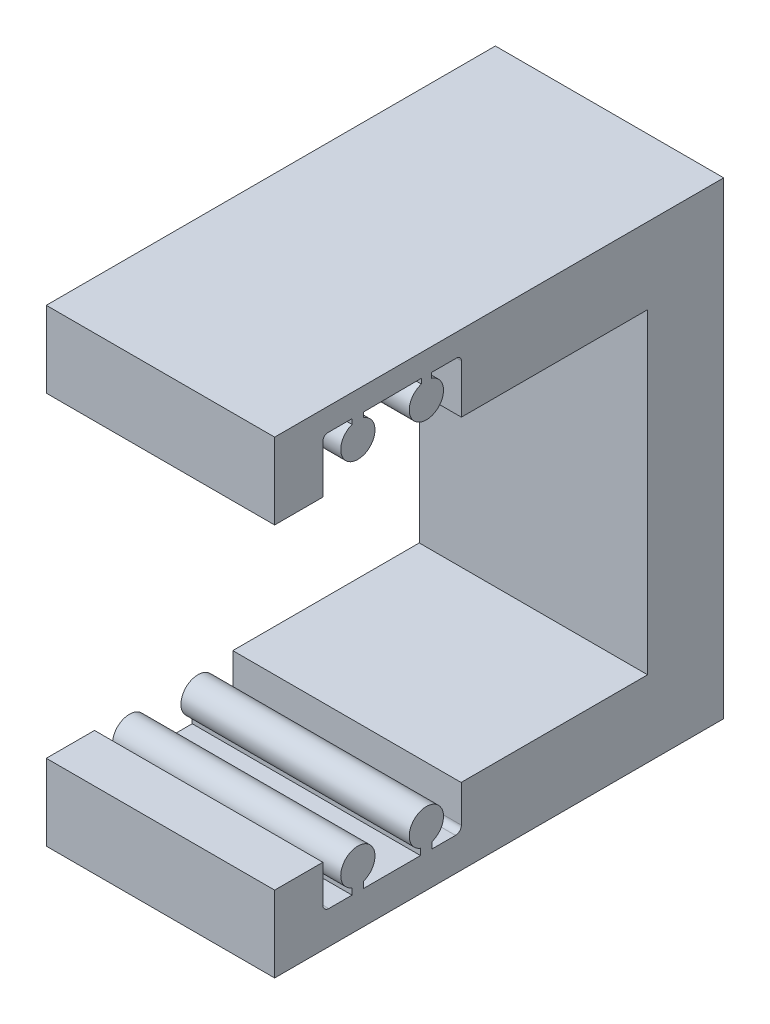
from build123d import *

# Parameters (mm, degrees)
ESBO_O1_W                  = 30
ESBO_O1_H                  = 10
RESSALTO_EXTRUS_O1_DEPTH   = 59
RESSALTO_EXTRUS_O1_2_DEPTH = 59
ESBO_O2_W                  = 30
ESBO_O2_H                  = 41.54
RESSALTO_EXTRUS_O2_DEPTH   = 10
CORTE_EXTRUS_O1_DEPTH      = 73.991731724
CORTE_EXTRUS_O2_DEPTH      = 4


with BuildPart() as part:
    # Esboço1 → Ressalto-extrusão1 (new body)
    with BuildSketch(Plane.XY):
        with Locations((0, 25.77)):
            Rectangle(ESBO_O1_W, ESBO_O1_H)
    extrude(amount=RESSALTO_EXTRUS_O1_DEPTH)



with BuildPart() as body_2:
    # Esboço1 → Ressalto-extrus_o1 2 (new body)
    with BuildSketch(Plane.XY):
        with Locations((0, -25.77)):
            Rectangle(ESBO_O1_W, ESBO_O1_H)
    extrude(amount=RESSALTO_EXTRUS_O1_2_DEPTH)


with BuildPart() as part_1:
    add(part.part)

    add(body_2.part)  # Ressalto-extrusão2 merges body 2
    # Esboço2 → Ressalto-extrusão2 (add)
    with BuildSketch(Plane(origin=(0, 0, 0), x_dir=(-1, 0, 0), z_dir=(0, 0, -1))):
        Rectangle(ESBO_O2_W, ESBO_O2_H)
    extrude(amount=-RESSALTO_EXTRUS_O2_DEPTH)

    # Esboço3 → Corte-extrusão1 (cut, through all)
    with BuildSketch(Plane.ZY.offset(15)):
        with BuildLine():
            ThreePointArc((51.8897547, -26.423845407), (52.437454615, -26.196980674), (52.664319348, -25.649280759))
            Line((52.664319348, -25.649280759), (52.664319348, -20.77))
            Line((52.664319348, -20.77), (52.564319348, -20.77))
            Line((52.564319348, -20.77), (34.5, -20.77))
            Line((34.5, -20.77), (34.464319348, -20.770417185))
            Line((34.464319348, -20.770417185), (34.464319348, -25.649280759))
            ThreePointArc((34.464319348, -25.649280759), (34.69118408, -26.196980674), (35.238883995, -26.423845407))
            Line((35.238883995, -26.423845407), (37.994984805, -26.423845407))
            Line((37.994984805, -26.423845407), (38.294984805, -26.423845407))
            Line((38.294984805, -26.423845407), (38.294984805, -25.584623249))
            ThreePointArc((38.294984805, -25.584623249), (39.064319348, -21.220238146), (39.83365389, -25.584623249))
            Line((39.83365389, -25.584623249), (39.83365389, -26.423845407))
            Line((39.83365389, -26.423845407), (40.13365389, -26.423845407))
            Line((40.13365389, -26.423845407), (47.294984805, -26.423845407))
            Line((47.294984805, -26.423845407), (47.294984805, -25.584623249))
            ThreePointArc((47.294984805, -25.584623249), (48.064319348, -21.220238146), (48.83365389, -25.584623249))
            Line((48.83365389, -25.584623249), (48.83365389, -26.423845407))
            Line((48.83365389, -26.423845407), (49.215424515, -26.423845407))
            Line((49.215424515, -26.423845407), (51.8897547, -26.423845407))
        make_face()
        with BuildLine():
            Line((34.464319348, 27.162244637), (34.464319348, 20.77))
            Line((34.464319348, 20.77), (34.5, 20.77))
            Line((34.5, 20.77), (52.564319348, 20.77))
            Line((52.564319348, 20.77), (52.664319348, 20.77))
            Line((52.664319348, 20.77), (52.664319348, 27.13384671))
            ThreePointArc((52.664319348, 27.13384671), (52.473932816, 27.593480457), (52.014299068, 27.783866989))
            Line((52.014299068, 27.783866989), (48.83365389, 27.783866989))
            Line((48.83365389, 27.783866989), (48.853388433, 27.775806736))
            Line((48.853388433, 27.775806736), (48.83365389, 27.775908805))
            Line((48.83365389, 27.775908805), (48.83365389, 27.124623249))
            ThreePointArc((48.83365389, 27.124623249), (48.064319348, 22.760238146), (47.294984805, 27.124623249))
            Line((47.294984805, 27.124623249), (47.294984805, 27.783866989))
            Line((47.294984805, 27.783866989), (40.021105511, 27.821488377))
            Line((40.021105511, 27.821488377), (39.721105511, 27.821488377))
            Line((39.721105511, 27.821488377), (39.721105511, 27.162244637))
            ThreePointArc((39.721105511, 27.162244637), (39.064319348, 22.760238146), (38.407533184, 27.162244637))
            Line((38.407533184, 27.162244637), (38.407533184, 27.821488377))
            Line((38.407533184, 27.821488377), (38.107533184, 27.821488377))
            Line((38.107533184, 27.821488377), (35.104983392, 27.821488377))
            ThreePointArc((35.104983392, 27.821488377), (34.654639493, 27.631168232), (34.464319348, 27.180824333))
            Line((34.464319348, 27.180824333), (34.464319348, 27.162244637))
        make_face()
    extrude(amount=-CORTE_EXTRUS_O1_DEPTH, mode=Mode.SUBTRACT)

    # Esboço4 → Corte-extrusão2 (cut)
    with BuildSketch(Plane.ZY.offset(15)):
        with BuildLine():
            Line((47.294984805, 27.783866989), (48.853388433, 27.775806736))
            Line((48.853388433, 27.775806736), (48.853388433, 27.117338044))
            ThreePointArc((48.853388433, 27.117338044), (48.055619332, 22.760254966), (47.291568671, 27.123377136))
            Line((47.291568671, 27.123377136), (47.294984805, 27.783866989))
        make_face()
        with BuildLine():
            Line((38.407533184, 27.821488377), (38.407533184, 27.162244637))
            ThreePointArc((38.407533184, 27.162244637), (39.064319348, 22.760238146), (39.721105511, 27.162244637))
            Line((39.721105511, 27.162244637), (39.721105511, 27.821488377))
            Line((39.721105511, 27.821488377), (38.407533184, 27.821488377))
        make_face()
    extrude(amount=-CORTE_EXTRUS_O2_DEPTH, mode=Mode.SUBTRACT)


solid = part_1.part
